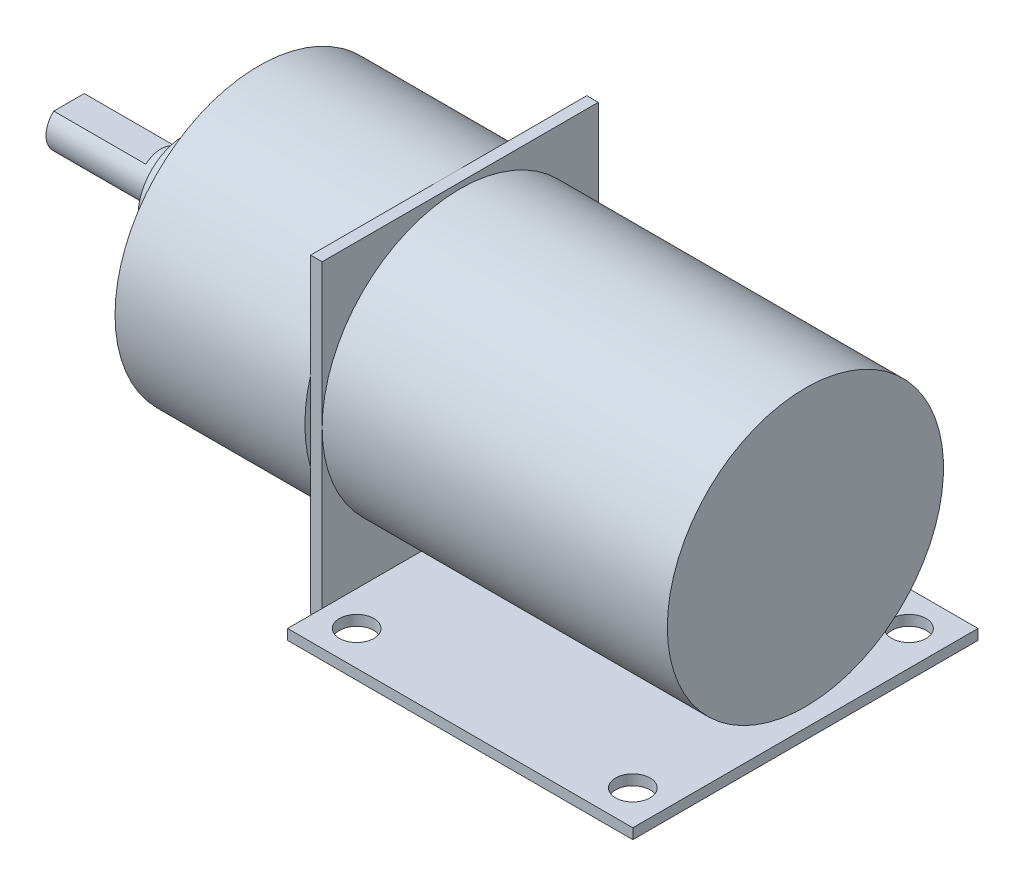
from build123d import *

# Parameters (mm, degrees)
SKETCH1_W           = 30
SKETCH1_H           = 30
SKETCH1_R           = 1.5
BOSS_EXTRUDE2_DEPTH = 0.9
SKETCH9_W           = 1
SKETCH9_H           = 24
BOSS_EXTRUDE3_DEPTH = 27
SKETCH10_R          = 12
BOSS_EXTRUDE4_DEPTH = 30
SKETCH11_R          = 12.5
BOSS_EXTRUDE5_DEPTH = 16.5
SKETCH12_R          = 4
BOSS_EXTRUDE6_DEPTH = 6.5
SKETCH13_R          = 2
BOSS_EXTRUDE7_DEPTH = 10
CUT_EXTRUDE1_START  = -8
CUT_EXTRUDE1_DEPTH  = 8


with BuildPart() as part:
    # Sketch1 → Boss-Extrude2 (new body)
    with BuildSketch(Plane(origin=(0, 0, 0), x_dir=(1, 0, 0), z_dir=(0, 1, 0))):
        Rectangle(SKETCH1_W, SKETCH1_H)
        with Locations(Location((-12, 12, 0), (0, 0, 270))):
            Circle(SKETCH1_R, mode=Mode.SUBTRACT)
        with Locations(Location((12, 12, 0), (0, 0, 270))):
            Circle(SKETCH1_R, mode=Mode.SUBTRACT)
        with Locations(Location((12, -12, 0), (0, 0, 270))):
            Circle(SKETCH1_R, mode=Mode.SUBTRACT)
        with Locations(Location((-12, -12, 0), (0, 0, 270))):
            Circle(SKETCH1_R, mode=Mode.SUBTRACT)
    extrude(amount=BOSS_EXTRUDE2_DEPTH)

    # Sketch9 → Boss-Extrude3 (add)
    with BuildSketch(Plane(origin=(0, 0, 0), x_dir=(1, 0, 0), z_dir=(0, 1, 0))):
        with Locations((-15.5, 0)):
            Rectangle(SKETCH9_W, SKETCH9_H)
    extrude(amount=BOSS_EXTRUDE3_DEPTH)

    # Sketch10 → Boss-Extrude4 (add)
    with BuildSketch(Plane(origin=(-15, 0, 0), x_dir=(0, 0, -1), z_dir=(1, 0, 0))):
        with Locations(Location((0, 14.5, 0), (0, 0, 180))):
            Circle(SKETCH10_R)
    extrude(amount=BOSS_EXTRUDE4_DEPTH)

    # Sketch11 → Boss-Extrude5 (add)
    with BuildSketch(Plane.ZY.offset(16)):
        with Locations(Location((0, 14.5, 0), (0, 0, 163.739795292))):
            Circle(SKETCH11_R)
    extrude(amount=BOSS_EXTRUDE5_DEPTH)

    # Sketch12 → Boss-Extrude6 (add)
    with BuildSketch(Plane.ZY.offset(32.5)):
        with Locations(Location((0, 14.5, 0), (0, 0, 180))):
            Circle(SKETCH12_R)
    extrude(amount=BOSS_EXTRUDE6_DEPTH)

    # Sketch13 → Boss-Extrude7 (add)
    with BuildSketch(Plane.ZY.offset(39)):
        with Locations((0, 14.5)):
            Circle(SKETCH13_R)
    extrude(amount=BOSS_EXTRUDE7_DEPTH)

    # Sketch14 → Cut-Extrude1 (cut)
    with BuildSketch(Plane.ZY.offset(49).offset(CUT_EXTRUDE1_START)):
        with BuildLine():
            Line((-1.322875656, 16), (1.322875656, 16))
            ThreePointArc((1.322875656, 16), (0, 16.5), (-1.322875656, 16))
        make_face()
    extrude(amount=CUT_EXTRUDE1_DEPTH, mode=Mode.SUBTRACT)


solid = part.part
